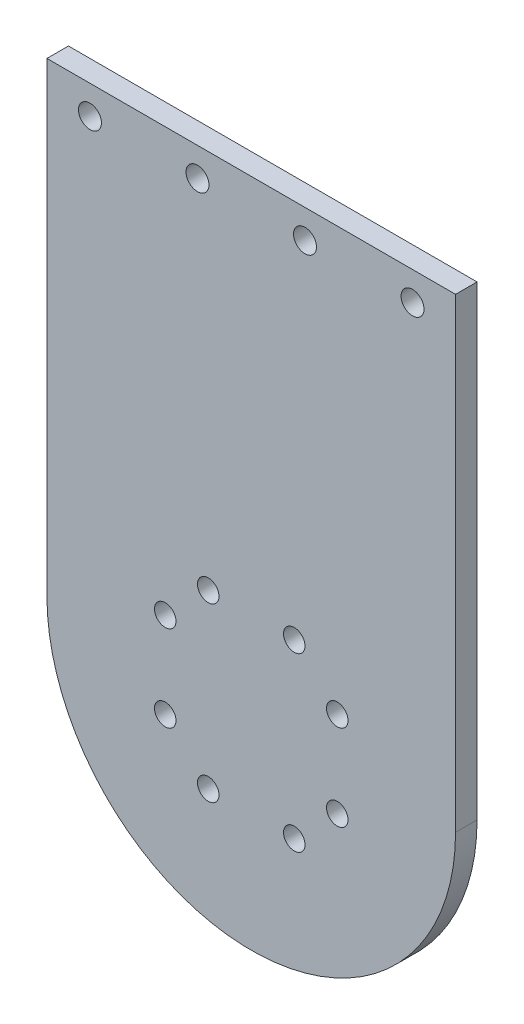
from build123d import *

# Parameters (mm, degrees)
EXTRUDE_1_DEPTH          = 3
CUT_EXTRUDE_2_REACH      = 99.793
SKETCH_3_R               = 1.6
PATTERN_LINEAR_1_COUNT   = 4
PATTERN_LINEAR_1_PITCH   = 15
CUT_EXTRUDE_1_REACH      = 99.793
SKETCH_2_R               = 1.5
PATTERN_CIRCULAR_1_COUNT = 4


with BuildPart() as part:
    # 草圖1 → 填料-伸長1 (new body)
    with BuildSketch(Plane.XY):
        with BuildLine():
            Line((-28.5, 0), (28.5, 0))
            Line((28.5, 0), (28.5, -65))
            ThreePointArc((28.5, -65), (0, -93.5), (-28.5, -65))
            Line((-28.5, -65), (-28.5, 0))
        make_face()
    extrude(amount=EXTRUDE_1_DEPTH)

    # 草圖3 → 除料-伸長2 (cut, up to next)
    with BuildSketch(Plane.XY.offset(3), mode=Mode.PRIVATE) as cut_extrude_2_sk1:
        with Locations((-22.5, -4)):
            Circle(SKETCH_3_R)
    cut_extrude_2_tool1 = extrude(cut_extrude_2_sk1.sketch, amount=-CUT_EXTRUDE_2_REACH, mode=Mode.PRIVATE) & part.part
    cut_extrude_2 = cut_extrude_2_tool1.solids().sort_by_distance((-22.5, -4, 3))[0]
    add(cut_extrude_2, mode=Mode.SUBTRACT)

    # 直線複製排列1: 除料-伸長2 ×4
    with Locations(*[(i * PATTERN_LINEAR_1_PITCH, 0, 0) for i in range(1, PATTERN_LINEAR_1_COUNT)]):
        add(cut_extrude_2, mode=Mode.SUBTRACT)

    # 草圖2 → 除料-伸長1 (cut, up to next)
    with BuildSketch(Plane.XY.offset(3), mode=Mode.PRIVATE) as cut_extrude_1_sk1:
        with Locations((-6, -53)):
            Circle(SKETCH_2_R)
    cut_extrude_1_tool1 = extrude(cut_extrude_1_sk1.sketch, amount=-CUT_EXTRUDE_1_REACH, mode=Mode.PRIVATE) & part.part
    # 草圖2 → 除料-伸長1 (cut, up to next)
    with BuildSketch(Plane.XY.offset(3), mode=Mode.PRIVATE) as cut_extrude_1_sk2:
        with Locations((-12, -59)):
            Circle(SKETCH_2_R)
    cut_extrude_1_tool2 = extrude(cut_extrude_1_sk2.sketch, amount=-CUT_EXTRUDE_1_REACH, mode=Mode.PRIVATE) & part.part
    cut_extrude_1_1 = cut_extrude_1_tool1.solids().sort_by_distance((-6, -53, 3))[0]
    add(cut_extrude_1_1, mode=Mode.SUBTRACT)
    cut_extrude_1_2 = cut_extrude_1_tool2.solids().sort_by_distance((-12, -59, 3))[0]
    add(cut_extrude_1_2, mode=Mode.SUBTRACT)
    cut_extrude_1 = cut_extrude_1_1 + cut_extrude_1_2  # 除料-伸長1 as one shape, for the pattern or mirror that repeats it

    # 環狀複製排列1: 除料-伸長1 ×4 about axis
    pattern_circular_1_axis = Axis((0, -65, 0), (0, 0, 1))
    for i in range(1, PATTERN_CIRCULAR_1_COUNT):
        add(cut_extrude_1.rotate(pattern_circular_1_axis, i * 360 / PATTERN_CIRCULAR_1_COUNT), mode=Mode.SUBTRACT)


solid = part.part
